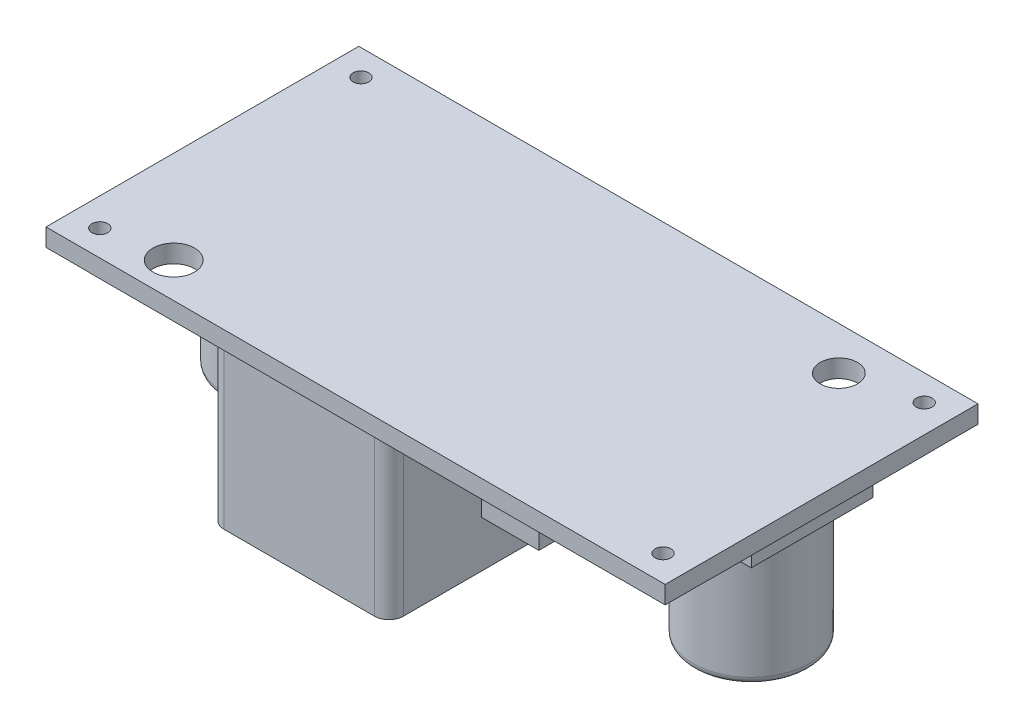
from build123d import *
from OCP.BRepFilletAPI import BRepFilletAPI_MakeChamfer

# Parameters (mm, degrees)
SKETCH1_W            = 43.15
SKETCH1_H            = 21.8
BOSS_EXTRUDE1_DEPTH  = 1.25
SKETCH2_R            = 0.55
CUT_EXTRUDE1_DEPTH   = 25.204403009
SKETCH3_R            = 1.3
SKETCH3_R_2          = 1.45
CUT_EXTRUDE2_DEPTH   = 25.204403009
SKETCH4_W            = 3
SKETCH4_H            = 3
CUT_EXTRUDE3_DEPTH   = 0.01
SKETCH5_W            = 0.089743589
SKETCH5_H            = 1
SKETCH5_W_2          = 0.384615385
SKETCH5_H_2          = 0.102564102
CUT_EXTRUDE4_DEPTH   = 0.01
SKETCH6_W            = 8.5
SKETCH6_H            = 8.5
BOSS_EXTRUDE2_DEPTH  = 1.75
SKETCH7_R            = 4.05
BOSS_EXTRUDE3_DEPTH  = 8.5
FILLET1_R            = 0.5
SKETCH8_W            = 12.5
SKETCH8_H            = 12.5
BOSS_EXTRUDE4_DEPTH  = 12
FILLET2_R            = 1
BOSS_EXTRUDE5_DEPTH  = 10
SKETCH10_W           = 4
SKETCH10_H           = 2.5
BOSS_EXTRUDE6_DEPTH  = 2.3
SKETCH11_W           = 10
SKETCH11_H           = 8.4
BOSS_EXTRUDE7_DEPTH  = 4.3
CHAMFER1_SIZE        = 2
CHAMFER1_SIZE2       = 0.727940469
SKETCH12_W           = 10
SKETCH12_H           = 1.5
BOSS_EXTRUDE8_DEPTH  = 1
SKETCH13_W           = 1
SKETCH13_H           = 5
BOSS_EXTRUDE9_DEPTH  = 1
LPATTERN1_COUNT      = 5
LPATTERN1_PITCH      = 1.9
SKETCH14_R           = 1.15
BOSS_EXTRUDE10_DEPTH = 1.6


with BuildPart() as part:
    # Sketch1 → Boss-Extrude1 (new body)
    with BuildSketch(Plane(origin=(0, 0, 0), x_dir=(1, 0, 0), z_dir=(0, 1, 0))):
        Rectangle(SKETCH1_W, SKETCH1_H)
    extrude(amount=BOSS_EXTRUDE1_DEPTH)

    # Sketch2 → Cut-Extrude1 (cut, through all)
    with BuildSketch(Plane(origin=(0, 1.25, 0), x_dir=(1, 0, 0), z_dir=(0, 1, 0))):
        with Locations(Location((19.625, 9.1, 0), (0, 0, 270))):
            Circle(SKETCH2_R)
        with Locations(Location((19.625, -9.1, 0), (0, 0, 270))):
            Circle(SKETCH2_R)
        with Locations(Location((-19.625, 9.1, 0), (0, 0, 270))):
            Circle(SKETCH2_R)
        with Locations(Location((-19.625, -9.1, 0), (0, 0, 270))):
            Circle(SKETCH2_R)
    extrude(amount=-CUT_EXTRUDE1_DEPTH, mode=Mode.SUBTRACT)

    # Sketch3 → Cut-Extrude2 (cut, through all)
    with BuildSketch(Plane(origin=(0, 1.25, 0), x_dir=(1, 0, 0), z_dir=(0, 1, 0))):
        with Locations(Location((14.875, 7.9, 0), (0, 0, 270))):
            Circle(SKETCH3_R)
        with Locations(Location((-15.125, -8.45, 0), (0, 0, 270))):
            Circle(SKETCH3_R_2)
    extrude(amount=-CUT_EXTRUDE2_DEPTH, mode=Mode.SUBTRACT)

    # Sketch4 → Cut-Extrude3 (cut)
    with BuildSketch(Plane.XZ):
        with Locations((20.075, -9.4)):
            Rectangle(SKETCH4_W, SKETCH4_H)
        with Locations((20.075, 9.4)):
            Rectangle(SKETCH4_W, SKETCH4_H)
        with Locations((-20.075, 9.4)):
            Rectangle(SKETCH4_W, SKETCH4_H)
        with Locations((-20.075, -9.4)):
            Rectangle(SKETCH4_W, SKETCH4_H)
    extrude(amount=-CUT_EXTRUDE3_DEPTH, mode=Mode.SUBTRACT)

    # Sketch5 → Cut-Extrude4 (cut)
    # profile 1 of 14: a face of its own
    with BuildSketch(Plane.XZ):
        with Locations((20.573564305, -7.20434754)):
            Rectangle(SKETCH5_W, SKETCH5_H)
    # profile 2 of 14: a face of its own
    with BuildSketch(Plane.XZ):
        Polygon((20.310743792, -6.70434754), (20.310743792, -7.70434754), (20.291913663, -7.70434754), (19.631256612, -6.917288246), (19.631256612, -7.70434754), (19.541513022, -7.70434754), (19.541513022, -6.70434754), (19.561945715, -6.70434754), (20.221000202, -7.489603951), (20.221000202, -6.70434754), align=None)
    # profile 3 of 14: a face of its own
    with BuildSketch(Plane.XZ):
        Polygon((19.041513022, -7.242809079), (19.041513022, -7.537680874), (18.951769433, -7.537680874), (18.951769433, -7.242809079), (18.656897638, -7.242809079), (18.656897638, -7.153065489), (18.951769433, -7.153065489), (18.951769433, -6.858193694), (19.041513022, -6.858193694), (19.041513022, -7.153065489), (19.336384817, -7.153065489), (19.336384817, -7.242809079), align=None)
    # profile 4 of 14: a face of its own
    with BuildSketch(Plane.XZ):
        with Locations((20.573564305, 7.050014745)):
            Rectangle(SKETCH5_W, SKETCH5_H)
    # profile 5 of 14: a face of its own
    with BuildSketch(Plane.XZ):
        Polygon((20.310743792, 7.550014745), (20.310743792, 6.550014745), (20.291913663, 6.550014745), (19.631256612, 7.337074039), (19.631256612, 6.550014745), (19.541513022, 6.550014745), (19.541513022, 7.550014745), (19.561945715, 7.550014745), (20.221000202, 6.764758334), (20.221000202, 7.550014745), align=None)
    # profile 6 of 14: a face of its own
    with BuildSketch(Plane.XZ):
        with Locations((19.182538664, 7.16539936)):
            Rectangle(SKETCH5_W_2, SKETCH5_H_2)
    # profile 7 of 14: a face of its own
    with BuildSketch(Plane.XZ):
        with BuildLine():
            add(Edge.make_bspline(
                [(-18.368582224, -7.729988566), (-18.38710084, -7.729527463), (-18.423472932, -7.728621818), (-18.476879134, -7.721460512), (-18.528017723, -7.709673427), (-18.576919243, -7.693028676), (-18.623393505, -7.671446786), (-18.667587441, -7.645245887), (-18.709349143, -7.614168476), (-18.748570597, -7.578952276), (-18.784219107, -7.540242315), (-18.815239087, -7.498684445), (-18.841639984, -7.45511511), (-18.86321046, -7.409250571), (-18.880159794, -7.361295598), (-18.891849075, -7.310964515), (-18.89931763, -7.258591548), (-18.900190639, -7.222869536), (-18.900633506, -7.204748181)],
                knots=[0, 0, 0, 0, 1.065027606, 2.091802087, 3.093458616, 4.079833113, 5.057734272, 6.036020118, 7.030157768, 8.047461502, 9.064242947, 10.052216774, 11.02588392, 11.989864716, 12.962978571, 13.945936472, 14.957997893, 16, 16, 16, 16], degree=3))
            add(Edge.make_bspline(
                [(-18.900633506, -7.204748181), (-18.90019049, -7.186760417), (-18.899317256, -7.15130445), (-18.891843006, -7.099262352), (-18.880107666, -7.04924053), (-18.863420139, -7.001355329), (-18.841833774, -6.955583238), (-18.815391336, -6.911983419), (-18.784441048, -6.870304371), (-18.748938698, -6.831405973), (-18.710169843, -6.795754174), (-18.668868728, -6.764237449), (-18.625085193, -6.737982209), (-18.579502591, -6.716089273), (-18.531667274, -6.699508299), (-18.481916612, -6.687425442), (-18.429968515, -6.680032155), (-18.394581428, -6.679153244), (-18.376595044, -6.678706515)],
                knots=[0, 0, 0, 0, 1.043683505, 2.0572211, 3.045299494, 4.022276905, 4.994977706, 5.977452478, 6.97747046, 8.003698437, 9.029677512, 10.031249186, 11.013723958, 11.988083691, 12.9614021, 13.946617861, 14.956316495, 16, 16, 16, 16], degree=3))
            add(Edge.make_bspline(
                [(-18.376595044, -6.678706515), (-18.358473775, -6.679149137), (-18.322751929, -6.680021664), (-18.270313284, -6.687502917), (-18.219946351, -6.699197309), (-18.171806209, -6.715925718), (-18.125877061, -6.737463833), (-18.082163349, -6.763930978), (-18.040612543, -6.795118874), (-18.001647471, -6.830593343), (-17.966038663, -6.869287857), (-17.93471866, -6.910534742), (-17.908404103, -6.953941717), (-17.886856896, -6.99932985), (-17.869813875, -7.04658182), (-17.85818285, -7.09599486), (-17.850658584, -7.147292082), (-17.849791445, -7.182218594), (-17.849351454, -7.199940489)],
                knots=[0, 0, 0, 0, 1.053167129, 2.076072758, 3.073341244, 4.055601477, 5.033424535, 6.017524495, 7.021518915, 8.049444456, 9.077120685, 10.074910483, 11.055688766, 12.022980584, 12.991883888, 13.970269434, 14.970104079, 16, 16, 16, 16], degree=3))
            add(Edge.make_bspline(
                [(-17.849351454, -7.199940489), (-17.849504067, -7.211835592), (-17.849807368, -7.235475735), (-17.853464198, -7.270579678), (-17.858759817, -7.305122864), (-17.866388969, -7.338989175), (-17.876229927, -7.372184142), (-17.888357238, -7.404639879), (-17.902255142, -7.436623726), (-17.918802516, -7.467526974), (-17.936856197, -7.497398127), (-17.956541921, -7.525863672), (-17.977996948, -7.552415137), (-18.000914797, -7.577479162), (-18.025612702, -7.60062796), (-18.051718962, -7.622366229), (-18.079370174, -7.642468942), (-18.108610072, -7.660513888), (-18.138693172, -7.677088389), (-18.169837729, -7.690926734), (-18.201386624, -7.703157975), (-18.233617752, -7.712878184), (-18.266456557, -7.720613585), (-18.299944091, -7.725869594), (-18.334045863, -7.729534549), (-18.357020572, -7.729836576), (-18.368582224, -7.729988566)],
                knots=[0, 0, 0, 0, 1.037115869, 2.061148057, 3.07517727, 4.084041727, 5.086514338, 6.092668487, 7.104487461, 8.125783165, 9.147610153, 10.147694368, 11.141876323, 12.122903372, 13.107606018, 14.091946891, 15.084523921, 16.086505767, 17.087268121, 18.077809654, 19.05670789, 20.036870126, 21.011670792, 21.99694167, 22.991993299, 24, 24, 24, 24], degree=3))
        make_face()
        with BuildLine():
            add(Edge.make_bspline(
                [(-18.372989275, -7.627424463), (-18.363499236, -7.627309239), (-18.344609885, -7.627079893), (-18.316530705, -7.624040047), (-18.288810757, -7.619742766), (-18.26151094, -7.613485632), (-18.234606841, -7.605468265), (-18.208068597, -7.595567965), (-18.18187251, -7.584010035), (-18.156258128, -7.570593876), (-18.131634524, -7.555555754), (-18.107853744, -7.539700581), (-18.085824005, -7.522129706), (-18.065119795, -7.503494722), (-18.045791345, -7.483539051), (-18.027836073, -7.462409697), (-18.011271668, -7.440011003), (-17.996296681, -7.416436295), (-17.982970153, -7.391816886), (-17.971038343, -7.366623478), (-17.96114733, -7.340559972), (-17.953312174, -7.31378902), (-17.946661922, -7.286428592), (-17.942490391, -7.25832962), (-17.939421421, -7.229588972), (-17.939204674, -7.210165474), (-17.939095044, -7.20034113)],
                knots=[0, 0, 0, 0, 1.008431664, 2.007222653, 2.999229743, 3.989431819, 4.982149843, 5.98167215, 6.998687425, 8.024288174, 9.053028776, 10.065052016, 11.06063401, 12.045759335, 13.024701188, 14.011819507, 14.991481775, 15.984022113, 16.97831254, 17.965966747, 18.945551853, 19.938269878, 20.93007375, 21.936103907, 22.956087853, 24, 24, 24, 24], degree=3))
            add(Edge.make_bspline(
                [(-17.939095044, -7.20034113), (-17.939460124, -7.18589511), (-17.940178348, -7.157475319), (-17.946440049, -7.115822591), (-17.956161959, -7.075753585), (-17.970256891, -7.037507125), (-17.988237759, -7.000912661), (-18.010170767, -6.966112605), (-18.036256775, -6.933117223), (-18.065870762, -6.902172133), (-18.098252876, -6.873938567), (-18.132621434, -6.849121115), (-18.168704526, -6.828234054), (-18.206294178, -6.810772941), (-18.245711323, -6.797618465), (-18.286703235, -6.78823933), (-18.329270818, -6.782160446), (-18.35827816, -6.781570042), (-18.372989275, -6.781270617)],
                knots=[0, 0, 0, 0, 1.032022337, 2.030307203, 3.003823408, 3.974715386, 4.937372378, 5.913284036, 6.909147208, 7.938749767, 8.970518239, 9.975863271, 10.963918693, 11.946286286, 12.933361397, 13.927862637, 14.949112547, 16, 16, 16, 16], degree=3))
            add(Edge.make_bspline(
                [(-18.372989275, -6.781270617), (-18.382877743, -6.781406366), (-18.402489546, -6.781675596), (-18.43165912, -6.784391115), (-18.460305908, -6.788737028), (-18.488376886, -6.795025268), (-18.515909176, -6.802790779), (-18.542818434, -6.812424594), (-18.569100478, -6.823967656), (-18.594866621, -6.836852657), (-18.619558769, -6.851384521), (-18.642896516, -6.867351479), (-18.665033336, -6.884326002), (-18.685699755, -6.902826032), (-18.704947512, -6.922613368), (-18.722581883, -6.943832117), (-18.739138565, -6.966063017), (-18.754008519, -6.989631733), (-18.767517861, -7.014056337), (-18.779099158, -7.039323086), (-18.788995854, -7.065271951), (-18.79697217, -7.091928539), (-18.803226038, -7.119231138), (-18.807534348, -7.147219297), (-18.810548252, -7.175836215), (-18.810775408, -7.195191607), (-18.810889916, -7.204948502)],
                knots=[0, 0, 0, 0, 1.047362266, 2.077233941, 3.100744636, 4.115120168, 5.122788643, 6.129711893, 7.140355774, 8.162227187, 9.180148637, 10.17298275, 11.156396779, 12.133377858, 13.108923632, 14.078087502, 15.054351192, 16.043448276, 17.028082865, 18.009331763, 18.985518559, 19.968016174, 20.954783108, 21.950335389, 22.966780876, 24, 24, 24, 24], degree=3))
            add(Edge.make_bspline(
                [(-18.810889916, -7.204948502), (-18.810775312, -7.214638646), (-18.810547975, -7.233860832), (-18.807535839, -7.262278208), (-18.803221299, -7.29006484), (-18.797003382, -7.317111641), (-18.788989053, -7.343425506), (-18.779106957, -7.368981718), (-18.767454019, -7.393875494), (-18.754080225, -7.41804527), (-18.73904719, -7.441238137), (-18.722620051, -7.463409943), (-18.704516458, -7.484146175), (-18.685248916, -7.503951738), (-18.664354196, -7.522430498), (-18.641828634, -7.539510993), (-18.618233153, -7.555963051), (-18.593033905, -7.570522608), (-18.56712142, -7.584038293), (-18.54050506, -7.595559652), (-18.513517662, -7.605512241), (-18.48612318, -7.613451103), (-18.458368938, -7.619748844), (-18.430247222, -7.62403849), (-18.401768476, -7.627080219), (-18.382612784, -7.627309351), (-18.372989275, -7.627424463)],
                knots=[0, 0, 0, 0, 1.02988216, 2.042960975, 3.035124439, 4.018561492, 4.99104521, 5.957523397, 6.929462691, 7.91146347, 8.892205782, 9.866320947, 10.842813644, 11.816825305, 12.802668543, 13.805243666, 14.821427616, 15.858893029, 16.897256944, 17.927432741, 18.940436917, 19.95373962, 20.957947499, 21.96413624, 22.977215056, 24, 24, 24, 24], degree=3))
        make_face(mode=Mode.SUBTRACT)
    # profile 8 of 14: a face of its own
    with BuildSketch(Plane.XZ):
        with BuildLine():
            Line((-19.105761711, -7.70434754), (-19.195505301, -7.70434754))
            Line((-19.195505301, -7.70434754), (-19.195505301, -7.105188887))
            add(Edge.make_bspline(
                [(-19.195505301, -7.105188887), (-19.195491945, -7.096708676), (-19.195466601, -7.080616016), (-19.195635891, -7.057710787), (-19.196109996, -7.037347228), (-19.196408899, -7.019446843), (-19.197073851, -7.004091772), (-19.19761615, -6.991198826), (-19.198313452, -6.980829054), (-19.199151486, -6.974777361), (-19.199511711, -6.972176066)],
                knots=[0, 0, 0, 0, 1.528628734, 2.90083645, 4.128790002, 5.200304208, 6.127813768, 6.898992206, 7.526736466, 8, 8, 8, 8], degree=3))
            add(Edge.make_bspline(
                [(-19.199511711, -6.972176066), (-19.200972681, -6.96271849), (-19.203793018, -6.944461064), (-19.211313216, -6.918494388), (-19.221256895, -6.894967818), (-19.233929246, -6.873618494), (-19.249558961, -6.854296305), (-19.268842928, -6.836815483), (-19.291741344, -6.821125667), (-19.317733544, -6.80736291), (-19.345445382, -6.795948363), (-19.373862777, -6.787403151), (-19.402442881, -6.782174425), (-19.421579401, -6.78157051), (-19.431082224, -6.781270617)],
                knots=[0, 0, 0, 0, 1.042923073, 2.013316119, 2.939979093, 3.821796737, 4.712412725, 5.640305549, 6.650442997, 7.732186751, 8.842579391, 9.91407549, 10.964170509, 12, 12, 12, 12], degree=3))
            add(Edge.make_bspline(
                [(-19.431082224, -6.781270617), (-19.439241167, -6.781575714), (-19.45551193, -6.782184145), (-19.479674294, -6.785998708), (-19.503282475, -6.792736533), (-19.526145917, -6.801919655), (-19.547912015, -6.813194438), (-19.567995575, -6.82679489), (-19.586185097, -6.842406149), (-19.602588639, -6.859955077), (-19.616866421, -6.879549214), (-19.629157428, -6.901086474), (-19.639199831, -6.924738634), (-19.644244776, -6.941407341), (-19.646827416, -6.949940489)],
                knots=[0, 0, 0, 0, 0.994543961, 1.983343699, 2.972712664, 3.980751554, 4.981834161, 5.954730495, 6.930176574, 7.89761099, 8.875938748, 9.87834379, 10.913868493, 12, 12, 12, 12], degree=3))
            add(Edge.make_bspline(
                [(-19.646827416, -6.949940489), (-19.647684595, -6.953468653), (-19.649594734, -6.961330825), (-19.651379604, -6.974622622), (-19.653238611, -6.990305297), (-19.654528488, -7.00849153), (-19.65578598, -7.029120379), (-19.656538286, -7.05229931), (-19.65688601, -7.077944156), (-19.656989633, -7.095840488), (-19.657043762, -7.105188887)],
                knots=[0, 0, 0, 0, 0.558680831, 1.244966039, 2.062412453, 2.990489873, 4.051219941, 5.244515665, 6.560634259, 8, 8, 8, 8], degree=3))
            Line((-19.657043762, -7.105188887), (-19.657043762, -7.70434754))
            Line((-19.657043762, -7.70434754), (-19.746787352, -7.70434754))
            Line((-19.746787352, -7.70434754), (-19.746787352, -7.100381194))
            add(Edge.make_bspline(
                [(-19.746787352, -7.100381194), (-19.746715538, -7.089495828), (-19.74657539, -7.068252374), (-19.745335645, -7.037125015), (-19.743415396, -7.007589937), (-19.740514726, -6.979684293), (-19.737305158, -6.95337668), (-19.732751804, -6.928763453), (-19.727909438, -6.905635808), (-19.721832335, -6.883951083), (-19.714603283, -6.863382087), (-19.705994517, -6.84354031), (-19.695509531, -6.824604275), (-19.683641199, -6.806226848), (-19.670146527, -6.788577391), (-19.655140581, -6.771518947), (-19.638383184, -6.755275772), (-19.620296672, -6.739770211), (-19.601027889, -6.725247988), (-19.580360656, -6.712883506), (-19.558664921, -6.702419257), (-19.536170782, -6.693506591), (-19.512498053, -6.686989185), (-19.487941602, -6.682096021), (-19.462328846, -6.679327946), (-19.444910587, -6.678915415), (-19.436090236, -6.678706515)],
                knots=[0, 0, 0, 0, 1.316485072, 2.56920066, 3.767172097, 4.895413872, 5.962239305, 6.971350037, 7.921780903, 8.819233545, 9.69278517, 10.557066787, 11.431700348, 12.307563454, 13.200791052, 14.11626757, 15.05287325, 16.020813301, 16.99640464, 17.967304965, 18.928075993, 19.907403966, 20.889159767, 21.893313923, 22.933205135, 24, 24, 24, 24], degree=3))
            add(Edge.make_bspline(
                [(-19.436090236, -6.678706515), (-19.426470423, -6.678930578), (-19.407596382, -6.679370189), (-19.379786501, -6.681893176), (-19.353121676, -6.686633269), (-19.327341664, -6.692707929), (-19.302695531, -6.700949216), (-19.279190538, -6.711075559), (-19.256556799, -6.722636319), (-19.235304248, -6.736297179), (-19.215258543, -6.751193427), (-19.19704158, -6.767555322), (-19.18019092, -6.78475972), (-19.165449304, -6.803454452), (-19.152259153, -6.823256821), (-19.14091112, -6.844259965), (-19.131163556, -6.86643573), (-19.126133233, -6.881851051), (-19.123590236, -6.889644015)],
                knots=[0, 0, 0, 0, 1.138939089, 2.234594419, 3.301501784, 4.342532435, 5.367382236, 6.373123747, 7.370098489, 8.372230273, 9.360297234, 10.323289009, 11.268038109, 12.20748145, 13.137029304, 14.081414587, 15.030090602, 16, 16, 16, 16], degree=3))
            add(Edge.make_bspline(
                [(-19.123590236, -6.889644015), (-19.122111048, -6.894967607), (-19.118902657, -6.906514599), (-19.115466857, -6.925625024), (-19.112578548, -6.947629286), (-19.109862674, -6.972528891), (-19.108260115, -7.000343139), (-19.106855132, -7.031059972), (-19.105751813, -7.064716533), (-19.105758319, -7.08816068), (-19.105761711, -7.100381194)],
                knots=[0, 0, 0, 0, 0.625038921, 1.35572334, 2.194682327, 3.136881307, 4.189498639, 5.346923369, 6.617055217, 8, 8, 8, 8], degree=3))
            Line((-19.105761711, -7.100381194), (-19.105761711, -7.70434754))
        make_face()
    # profile 9 of 14: a face of its own
    with BuildSketch(Plane.XZ):
        Polygon((-19.900633506, -7.601783438), (-19.900633506, -7.70434754), (-20.426274531, -7.70434754), (-20.426274531, -7.601783438), (-20.208325813, -7.601783438), (-20.208325813, -6.70434754), (-20.118582224, -6.70434754), (-20.118582224, -7.601783438), align=None)
    # profile 10 of 14: a face of its own
    with BuildSketch(Plane.XZ):
        Polygon((-20.849351454, -7.242809079), (-20.849351454, -7.537680874), (-20.939095044, -7.537680874), (-20.939095044, -7.242809079), (-21.233966839, -7.242809079), (-21.233966839, -7.153065489), (-20.939095044, -7.153065489), (-20.939095044, -6.858193694), (-20.849351454, -6.858193694), (-20.849351454, -7.153065489), (-20.554479659, -7.153065489), (-20.554479659, -7.242809079), align=None)
    # profile 11 of 14: a face of its own
    with BuildSketch(Plane.XZ):
        with BuildLine():
            add(Edge.make_bspline(
                [(-18.368582224, 6.524373719), (-18.38710084, 6.524834822), (-18.423472932, 6.525740467), (-18.476879134, 6.532901773), (-18.528017723, 6.544688858), (-18.576919243, 6.561333609), (-18.623393505, 6.582915499), (-18.667587441, 6.609116398), (-18.709349143, 6.640193809), (-18.748570597, 6.675410009), (-18.784219107, 6.71411997), (-18.815239087, 6.75567784), (-18.841639984, 6.799247175), (-18.86321046, 6.845111714), (-18.880159794, 6.893066687), (-18.891849075, 6.94339777), (-18.89931763, 6.995770737), (-18.900190639, 7.031492749), (-18.900633506, 7.049614104)],
                knots=[0, 0, 0, 0, 1.065027606, 2.091802087, 3.093458616, 4.079833113, 5.057734272, 6.036020118, 7.030157768, 8.047461502, 9.064242947, 10.052216774, 11.02588392, 11.989864716, 12.962978571, 13.945936472, 14.957997893, 16, 16, 16, 16], degree=3))
            add(Edge.make_bspline(
                [(-18.900633506, 7.049614104), (-18.90019049, 7.067601868), (-18.899317256, 7.103057835), (-18.891843006, 7.155099933), (-18.880107666, 7.205121755), (-18.863420139, 7.253006955), (-18.841833774, 7.298779047), (-18.815391336, 7.342378866), (-18.784441048, 7.384057914), (-18.748938698, 7.422956312), (-18.710169843, 7.458608111), (-18.668868728, 7.490124836), (-18.625085193, 7.516380076), (-18.579502591, 7.538273012), (-18.531667274, 7.554853986), (-18.481916612, 7.566936843), (-18.429968515, 7.57433013), (-18.394581428, 7.575209041), (-18.376595044, 7.57565577)],
                knots=[0, 0, 0, 0, 1.043683505, 2.0572211, 3.045299494, 4.022276905, 4.994977706, 5.977452478, 6.97747046, 8.003698437, 9.029677512, 10.031249186, 11.013723958, 11.988083691, 12.9614021, 13.946617861, 14.956316495, 16, 16, 16, 16], degree=3))
            add(Edge.make_bspline(
                [(-18.376595044, 7.57565577), (-18.358473775, 7.575213148), (-18.322751929, 7.574340621), (-18.270313284, 7.566859368), (-18.219946351, 7.555164976), (-18.171806209, 7.538436567), (-18.125877061, 7.516898452), (-18.082163349, 7.490431307), (-18.040612543, 7.459243411), (-18.001647471, 7.423768942), (-17.966038663, 7.385074428), (-17.93471866, 7.343827542), (-17.908404103, 7.300420568), (-17.886856896, 7.255032435), (-17.869813875, 7.207780465), (-17.85818285, 7.158367425), (-17.850658584, 7.107070203), (-17.849791445, 7.072143691), (-17.849351454, 7.054421796)],
                knots=[0, 0, 0, 0, 1.053167129, 2.076072758, 3.073341244, 4.055601477, 5.033424535, 6.017524495, 7.021518915, 8.049444456, 9.077120685, 10.074910483, 11.055688766, 12.022980584, 12.991883888, 13.970269434, 14.970104079, 16, 16, 16, 16], degree=3))
            add(Edge.make_bspline(
                [(-17.849351454, 7.054421796), (-17.849504067, 7.042526693), (-17.849807368, 7.01888655), (-17.853464198, 6.983782607), (-17.858759817, 6.949239421), (-17.866388969, 6.91537311), (-17.876229927, 6.882178143), (-17.888357238, 6.849722406), (-17.902255142, 6.817738559), (-17.918802516, 6.786835311), (-17.936856197, 6.756964158), (-17.956541921, 6.728498613), (-17.977996948, 6.701947148), (-18.000914797, 6.676883123), (-18.025612702, 6.653734325), (-18.051718962, 6.631996056), (-18.079370174, 6.611893343), (-18.108610072, 6.593848397), (-18.138693172, 6.577273896), (-18.169837729, 6.563435551), (-18.201386624, 6.55120431), (-18.233617752, 6.541484101), (-18.266456557, 6.5337487), (-18.299944091, 6.528492691), (-18.334045863, 6.524827736), (-18.357020572, 6.524525709), (-18.368582224, 6.524373719)],
                knots=[0, 0, 0, 0, 1.037115869, 2.061148057, 3.07517727, 4.084041727, 5.086514338, 6.092668487, 7.104487461, 8.125783165, 9.147610153, 10.147694368, 11.141876323, 12.122903372, 13.107606018, 14.091946891, 15.084523921, 16.086505767, 17.087268121, 18.077809654, 19.05670789, 20.036870126, 21.011670792, 21.99694167, 22.991993299, 24, 24, 24, 24], degree=3))
        make_face()
        with BuildLine():
            add(Edge.make_bspline(
                [(-18.372989275, 6.626937821), (-18.363499236, 6.627053046), (-18.344609885, 6.627282392), (-18.316530705, 6.630322238), (-18.288810757, 6.634619519), (-18.26151094, 6.640876653), (-18.234606841, 6.64889402), (-18.208068597, 6.65879432), (-18.18187251, 6.67035225), (-18.156258128, 6.683768409), (-18.131634524, 6.698806531), (-18.107853744, 6.714661704), (-18.085824005, 6.732232579), (-18.065119795, 6.750867563), (-18.045791345, 6.770823234), (-18.027836073, 6.791952588), (-18.011271668, 6.814351282), (-17.996296681, 6.83792599), (-17.982970153, 6.862545399), (-17.971038343, 6.887738807), (-17.96114733, 6.913802313), (-17.953312174, 6.940573265), (-17.946661922, 6.967933693), (-17.942490391, 6.996032665), (-17.939421421, 7.024773313), (-17.939204674, 7.044196811), (-17.939095044, 7.054021155)],
                knots=[0, 0, 0, 0, 1.008431664, 2.007222653, 2.999229743, 3.989431819, 4.982149843, 5.98167215, 6.998687425, 8.024288174, 9.053028776, 10.065052016, 11.06063401, 12.045759335, 13.024701188, 14.011819507, 14.991481775, 15.984022113, 16.97831254, 17.965966747, 18.945551853, 19.938269878, 20.93007375, 21.936103907, 22.956087853, 24, 24, 24, 24], degree=3))
            add(Edge.make_bspline(
                [(-17.939095044, 7.054021155), (-17.939460124, 7.068467175), (-17.940178348, 7.096886966), (-17.946440049, 7.138539694), (-17.956161959, 7.1786087), (-17.970256891, 7.21685516), (-17.988237759, 7.253449624), (-18.010170767, 7.28824968), (-18.036256775, 7.321245062), (-18.065870762, 7.352190152), (-18.098252876, 7.380423718), (-18.132621434, 7.40524117), (-18.168704526, 7.426128231), (-18.206294178, 7.443589344), (-18.245711323, 7.45674382), (-18.286703235, 7.466122955), (-18.329270818, 7.472201839), (-18.35827816, 7.472792243), (-18.372989275, 7.473091668)],
                knots=[0, 0, 0, 0, 1.032022337, 2.030307203, 3.003823408, 3.974715386, 4.937372378, 5.913284036, 6.909147208, 7.938749767, 8.970518239, 9.975863271, 10.963918693, 11.946286286, 12.933361397, 13.927862637, 14.949112547, 16, 16, 16, 16], degree=3))
            add(Edge.make_bspline(
                [(-18.372989275, 7.473091668), (-18.382877743, 7.472955919), (-18.402489546, 7.472686689), (-18.43165912, 7.46997117), (-18.460305908, 7.465625257), (-18.488376886, 7.459337017), (-18.515909176, 7.451571506), (-18.542818434, 7.441937691), (-18.569100478, 7.430394629), (-18.594866621, 7.417509628), (-18.619558769, 7.402977764), (-18.642896516, 7.387010806), (-18.665033336, 7.370036283), (-18.685699755, 7.351536253), (-18.704947512, 7.331748917), (-18.722581883, 7.310530168), (-18.739138565, 7.288299268), (-18.754008519, 7.264730552), (-18.767517861, 7.240305948), (-18.779099158, 7.215039199), (-18.788995854, 7.189090334), (-18.79697217, 7.162433746), (-18.803226038, 7.135131147), (-18.807534348, 7.107142988), (-18.810548252, 7.07852607), (-18.810775408, 7.059170678), (-18.810889916, 7.049413783)],
                knots=[0, 0, 0, 0, 1.047362266, 2.077233941, 3.100744636, 4.115120168, 5.122788643, 6.129711893, 7.140355774, 8.162227187, 9.180148637, 10.17298275, 11.156396779, 12.133377858, 13.108923632, 14.078087502, 15.054351192, 16.043448276, 17.028082865, 18.009331763, 18.985518559, 19.968016174, 20.954783108, 21.950335389, 22.966780876, 24, 24, 24, 24], degree=3))
            add(Edge.make_bspline(
                [(-18.810889916, 7.049413783), (-18.810775312, 7.039723639), (-18.810547975, 7.020501453), (-18.807535839, 6.992084077), (-18.803221299, 6.964297445), (-18.797003382, 6.937250644), (-18.788989053, 6.910936779), (-18.779106957, 6.885380567), (-18.767454019, 6.860486791), (-18.754080225, 6.836317015), (-18.73904719, 6.813124148), (-18.722620051, 6.790952342), (-18.704516458, 6.77021611), (-18.685248916, 6.750410546), (-18.664354196, 6.731931787), (-18.641828634, 6.714851292), (-18.618233153, 6.698399234), (-18.593033905, 6.683839677), (-18.56712142, 6.670323992), (-18.54050506, 6.658802633), (-18.513517662, 6.648850044), (-18.48612318, 6.640911182), (-18.458368938, 6.634613441), (-18.430247222, 6.630323795), (-18.401768476, 6.627282066), (-18.382612784, 6.627052934), (-18.372989275, 6.626937821)],
                knots=[0, 0, 0, 0, 1.02988216, 2.042960975, 3.035124439, 4.018561492, 4.99104521, 5.957523397, 6.929462691, 7.91146347, 8.892205782, 9.866320947, 10.842813644, 11.816825305, 12.802668543, 13.805243666, 14.821427616, 15.858893029, 16.897256944, 17.927432741, 18.940436917, 19.95373962, 20.957947499, 21.96413624, 22.977215056, 24, 24, 24, 24], degree=3))
        make_face(mode=Mode.SUBTRACT)
    # profile 12 of 14: a face of its own
    with BuildSketch(Plane.XZ):
        with BuildLine():
            Line((-19.105761711, 6.550014745), (-19.195505301, 6.550014745))
            Line((-19.195505301, 6.550014745), (-19.195505301, 7.149173398))
            add(Edge.make_bspline(
                [(-19.195505301, 7.149173398), (-19.195491945, 7.157653609), (-19.195466601, 7.173746269), (-19.195635891, 7.196651498), (-19.196109996, 7.217015057), (-19.196408899, 7.234915442), (-19.197073851, 7.250270513), (-19.19761615, 7.263163459), (-19.198313452, 7.273533231), (-19.199151486, 7.279584924), (-19.199511711, 7.282186219)],
                knots=[0, 0, 0, 0, 1.528628734, 2.90083645, 4.128790002, 5.200304208, 6.127813768, 6.898992206, 7.526736466, 8, 8, 8, 8], degree=3))
            add(Edge.make_bspline(
                [(-19.199511711, 7.282186219), (-19.200972681, 7.291643795), (-19.203793018, 7.309901221), (-19.211313216, 7.335867897), (-19.221256895, 7.359394467), (-19.233929246, 7.380743791), (-19.249558961, 7.40006598), (-19.268842928, 7.417546802), (-19.291741344, 7.433236618), (-19.317733544, 7.446999375), (-19.345445382, 7.458413922), (-19.373862777, 7.466959134), (-19.402442881, 7.47218786), (-19.421579401, 7.472791775), (-19.431082224, 7.473091668)],
                knots=[0, 0, 0, 0, 1.042923073, 2.013316119, 2.939979093, 3.821796737, 4.712412725, 5.640305549, 6.650442997, 7.732186751, 8.842579391, 9.91407549, 10.964170509, 12, 12, 12, 12], degree=3))
            add(Edge.make_bspline(
                [(-19.431082224, 7.473091668), (-19.439241167, 7.472786571), (-19.45551193, 7.47217814), (-19.479674294, 7.468363577), (-19.503282475, 7.461625751), (-19.526145917, 7.45244263), (-19.547912015, 7.441167847), (-19.567995575, 7.427567395), (-19.586185097, 7.411956136), (-19.602588639, 7.394407208), (-19.616866421, 7.374813071), (-19.629157428, 7.353275811), (-19.639199831, 7.329623651), (-19.644244776, 7.312954944), (-19.646827416, 7.304421796)],
                knots=[0, 0, 0, 0, 0.994543961, 1.983343699, 2.972712664, 3.980751554, 4.981834161, 5.954730495, 6.930176574, 7.89761099, 8.875938748, 9.87834379, 10.913868493, 12, 12, 12, 12], degree=3))
            add(Edge.make_bspline(
                [(-19.646827416, 7.304421796), (-19.647684595, 7.300893632), (-19.649594734, 7.29303146), (-19.651379604, 7.279739663), (-19.653238611, 7.264056988), (-19.654528488, 7.245870755), (-19.65578598, 7.225241906), (-19.656538286, 7.202062975), (-19.65688601, 7.176418129), (-19.656989633, 7.158521797), (-19.657043762, 7.149173398)],
                knots=[0, 0, 0, 0, 0.558680831, 1.244966039, 2.062412453, 2.990489873, 4.051219941, 5.244515665, 6.560634259, 8, 8, 8, 8], degree=3))
            Line((-19.657043762, 7.149173398), (-19.657043762, 6.550014745))
            Line((-19.657043762, 6.550014745), (-19.746787352, 6.550014745))
            Line((-19.746787352, 6.550014745), (-19.746787352, 7.153981091))
            add(Edge.make_bspline(
                [(-19.746787352, 7.153981091), (-19.746715538, 7.164866457), (-19.74657539, 7.186109911), (-19.745335645, 7.21723727), (-19.743415396, 7.246772348), (-19.740514726, 7.274677992), (-19.737305158, 7.300985605), (-19.732751804, 7.325598832), (-19.727909438, 7.348726477), (-19.721832335, 7.370411202), (-19.714603283, 7.390980198), (-19.705994517, 7.410821975), (-19.695509531, 7.42975801), (-19.683641199, 7.448135437), (-19.670146527, 7.465784894), (-19.655140581, 7.482843338), (-19.638383184, 7.499086513), (-19.620296672, 7.514592074), (-19.601027889, 7.529114297), (-19.580360656, 7.541478779), (-19.558664921, 7.551943028), (-19.536170782, 7.560855694), (-19.512498053, 7.5673731), (-19.487941602, 7.572266264), (-19.462328846, 7.575034339), (-19.444910587, 7.57544687), (-19.436090236, 7.57565577)],
                knots=[0, 0, 0, 0, 1.316485072, 2.56920066, 3.767172097, 4.895413872, 5.962239305, 6.971350037, 7.921780903, 8.819233545, 9.69278517, 10.557066787, 11.431700348, 12.307563454, 13.200791052, 14.11626757, 15.05287325, 16.020813301, 16.99640464, 17.967304965, 18.928075993, 19.907403966, 20.889159767, 21.893313923, 22.933205135, 24, 24, 24, 24], degree=3))
            add(Edge.make_bspline(
                [(-19.436090236, 7.57565577), (-19.426470423, 7.575431707), (-19.407596382, 7.574992096), (-19.379786501, 7.572469109), (-19.353121676, 7.567729016), (-19.327341664, 7.561654356), (-19.302695531, 7.553413069), (-19.279190538, 7.543286726), (-19.256556799, 7.531725966), (-19.235304248, 7.518065106), (-19.215258543, 7.503168858), (-19.19704158, 7.486806963), (-19.18019092, 7.469602565), (-19.165449304, 7.450907833), (-19.152259153, 7.431105464), (-19.14091112, 7.41010232), (-19.131163556, 7.387926555), (-19.126133233, 7.372511233), (-19.123590236, 7.36471827)],
                knots=[0, 0, 0, 0, 1.138939089, 2.234594419, 3.301501784, 4.342532435, 5.367382236, 6.373123747, 7.370098489, 8.372230273, 9.360297234, 10.323289009, 11.268038109, 12.20748145, 13.137029304, 14.081414587, 15.030090602, 16, 16, 16, 16], degree=3))
            add(Edge.make_bspline(
                [(-19.123590236, 7.36471827), (-19.122111048, 7.359394678), (-19.118902657, 7.347847686), (-19.115466857, 7.328737261), (-19.112578548, 7.306732999), (-19.109862674, 7.281833394), (-19.108260115, 7.254019146), (-19.106855132, 7.223302313), (-19.105751813, 7.189645752), (-19.105758319, 7.166201605), (-19.105761711, 7.153981091)],
                knots=[0, 0, 0, 0, 0.625038921, 1.35572334, 2.194682327, 3.136881307, 4.189498639, 5.346923369, 6.617055217, 8, 8, 8, 8], degree=3))
            Line((-19.105761711, 7.153981091), (-19.105761711, 6.550014745))
        make_face()
    # profile 13 of 14: a face of its own
    with BuildSketch(Plane.XZ):
        Polygon((-19.900633506, 6.652578847), (-19.900633506, 6.550014745), (-20.426274531, 6.550014745), (-20.426274531, 6.652578847), (-20.208325813, 6.652578847), (-20.208325813, 7.550014745), (-20.118582224, 7.550014745), (-20.118582224, 6.652578847), align=None)
    # profile 14 of 14: a face of its own
    with BuildSketch(Plane.XZ):
        with Locations((-20.708325814, 7.16539936)):
            Rectangle(SKETCH5_W_2, SKETCH5_H_2)
    extrude(amount=-CUT_EXTRUDE4_DEPTH, mode=Mode.SUBTRACT)

    # Sketch6 → Boss-Extrude2 (add)
    with BuildSketch(Plane.XZ):
        with Locations((16.325, -0.35)):
            Rectangle(SKETCH6_W, SKETCH6_H)
        with Locations((-16.325, -0.35)):
            Rectangle(SKETCH6_W, SKETCH6_H)
    extrude(amount=BOSS_EXTRUDE2_DEPTH)

    # Sketch7 → Boss-Extrude3 (add)
    with BuildSketch(Plane.XZ.offset(1.75)):
        with Locations(Location((-16.325, -0.35, 0), (0, 0, 270))):
            Circle(SKETCH7_R)
        with Locations(Location((16.325, -0.35, 0), (0, 0, 270))):
            Circle(SKETCH7_R)
    extrude(amount=BOSS_EXTRUDE3_DEPTH)

    # Fillet1
    fillet1_edges = [part.edges().sort_by_distance(p)[0] for p in [
        (-16.325, -10.25, 3.7),
        (16.325, -10.25, 3.7),
    ]]
    fillet(fillet1_edges, radius=FILLET1_R)

    # Sketch8 → Boss-Extrude4 (add)
    with BuildSketch(Plane.XZ):
        with Locations((-5.125, 3.45)):
            Rectangle(SKETCH8_W, SKETCH8_H)
    extrude(amount=BOSS_EXTRUDE4_DEPTH)

    # Fillet2
    fillet2_edges = [part.edges().sort_by_distance(p)[0] for p in [
        (-11.375, -6, 9.7),
        (-11.375, -6, -2.8),
        (1.125, -6, -2.8),
        (1.125, -6, 9.7),
    ]]
    fillet(fillet2_edges, radius=FILLET2_R)

    # Sketch9 → Boss-Extrude5 (add)
    with BuildSketch(Plane.XZ):
        Polygon((-10.225, -4.5), (-10.225, -5.2), (-2.125, -5.2), (-2.125, -4.5), (-1.425, -4.5), (-1.425, -9.5), (-10.925, -9.5), (-10.925, -4.5), align=None)
    extrude(amount=BOSS_EXTRUDE5_DEPTH)

    # Sketch10 → Boss-Extrude6 (add)
    with BuildSketch(Plane.XZ):
        with Locations((9.575, 8.45)):
            Rectangle(SKETCH10_W, SKETCH10_H)
    extrude(amount=BOSS_EXTRUDE6_DEPTH)

    # Sketch11 → Boss-Extrude7 (add)
    with BuildSketch(Plane.XZ):
        with Locations((6.625, -3.6)):
            Rectangle(SKETCH11_W, SKETCH11_H)
    extrude(amount=BOSS_EXTRUDE7_DEPTH)

    # Chamfer1: one chamfer whose edges measure the first distance from different faces: ONE call of the kernel's chamfer builder (chamfer() names one face for all edges)
    chamfer1_edges_1 = [part.edges().sort_by_distance(p)[0] for p in [
        (6.625, -4.3, -7.8),
    ]]
    chamfer1_side_1 = [part.faces().sort_by_distance(p)[0] for p in [
        (6.625, -2.15, -7.8),
    ]]
    chamfer1_edges_2 = [part.edges().sort_by_distance(p)[0] for p in [
        (6.625, -4.3, 0.6),
    ]]
    chamfer1_side_2 = [part.faces().sort_by_distance(p)[0] for p in [
        (6.625, -2.15, 0.6),
    ]]
    chamfer1 = BRepFilletAPI_MakeChamfer(part.part.solid().wrapped)
    for e in chamfer1_edges_1:
        chamfer1.Add(CHAMFER1_SIZE, CHAMFER1_SIZE2, e.wrapped, chamfer1_side_1[0].wrapped)  # the first distance lies on this face
    for e in chamfer1_edges_2:
        chamfer1.Add(CHAMFER1_SIZE, CHAMFER1_SIZE2, e.wrapped, chamfer1_side_2[0].wrapped)  # the first distance lies on this face
    add(Compound.cast(chamfer1.Shape()), mode=Mode.REPLACE)

    # Sketch12 → Boss-Extrude8 (add)
    with BuildSketch(Plane.XZ):
        with Locations((6.625, -8.55)):
            Rectangle(SKETCH12_W, SKETCH12_H)
    extrude(amount=BOSS_EXTRUDE8_DEPTH)

    # Sketch13 → Boss-Extrude9 (add)
    with BuildSketch(Plane.XZ):
        with Locations((2.875, 3.1)):
            Rectangle(SKETCH13_W, SKETCH13_H)
    boss_extrude9 = extrude(amount=BOSS_EXTRUDE9_DEPTH)

    # LPattern1: Boss-Extrude9 ×5
    with Locations(*[(i * LPATTERN1_PITCH, 0, 0) for i in range(1, LPATTERN1_COUNT)]):
        add(boss_extrude9)

    # Sketch14 → Boss-Extrude10 (add)
    with BuildSketch(Plane.XZ.offset(10)):
        with Locations((-2.575, -8.2)):
            Circle(SKETCH14_R)
    extrude(amount=BOSS_EXTRUDE10_DEPTH)


solid = part.part
